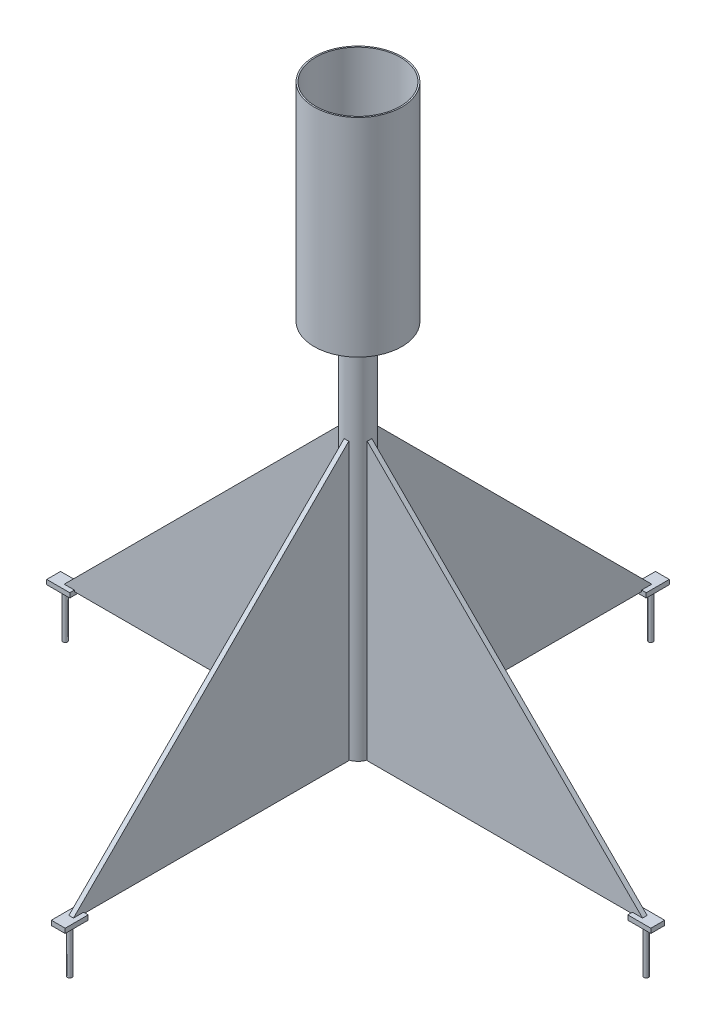
from build123d import *

# Parameters (mm, degrees)
SKETCH1_R            = 95
BOSS_EXTRUDE1_DEPTH  = 450
SHELL2_T             = -3
SKETCH2_R            = 30
BOSS_EXTRUDE2_DEPTH  = 805
SHELL3_T             = -3
BOSS_EXTRUDE3_DEPTH  = 10
BOSS_EXTRUDE4_DEPTH  = 10
BOSS_EXTRUDE5_DEPTH  = 10
BOSS_EXTRUDE6_DEPTH  = 10
SKETCH11_W           = 30
SKETCH11_H           = 50
BOSS_EXTRUDE7_DEPTH  = 10
SKETCH12_W           = 50
SKETCH12_H           = 30
BOSS_EXTRUDE8_DEPTH  = 10
SKETCH13_W           = 50
SKETCH13_H           = 30
BOSS_EXTRUDE9_DEPTH  = 10
SKETCH14_W           = 30
SKETCH14_H           = 50
BOSS_EXTRUDE10_DEPTH = 10
SKETCH17_R           = 5
BOSS_EXTRUDE11_DEPTH = 100
SKETCH18_R           = 5
BOSS_EXTRUDE12_DEPTH = 100
SKETCH19_R           = 5
BOSS_EXTRUDE13_DEPTH = 100
SKETCH20_R           = 5
BOSS_EXTRUDE14_DEPTH = 100


with BuildPart() as part:
    # Sketch1 → Boss-Extrude1 (new body)
    with BuildSketch(Plane(origin=(0, 0, 0), x_dir=(1, 0, 0), z_dir=(0, 1, 0))):
        with Locations(Location((0, 0, 0), (0, 0, 270))):
            Circle(SKETCH1_R)
    extrude(amount=BOSS_EXTRUDE1_DEPTH)

    # Shell2
    shell2_openings = [part.faces().sort_by_distance(p)[0] for p in [
        (0, 450, 0),
    ]]
    offset(amount=SHELL2_T, openings=shell2_openings, kind=Kind.INTERSECTION)

    # Sketch2 → Boss-Extrude2 (add)
    with BuildSketch(Plane.XZ):
        with Locations(Location((0, 0, 0), (0, 0, 270))):
            Circle(SKETCH2_R)
    extrude(amount=BOSS_EXTRUDE2_DEPTH)

    # Shell3
    shell3_openings = [part.faces().sort_by_distance(p)[0] for p in [
        (0, -805, 0),
    ]]
    offset(amount=SHELL3_T, openings=shell3_openings, kind=Kind.INTERSECTION)


with BuildPart() as body_2:
    # Sketch5 → Boss-Extrude3 (new body)
    with BuildSketch(Plane(origin=(0, 0, 0), x_dir=(0, 0, -1), z_dir=(1, 0, 0))):
        Polygon((-30, -205), (-630, -805), (-30, -805), align=None)
    extrude(amount=BOSS_EXTRUDE3_DEPTH)

    # Sketch14 → Boss-Extrude10 (add)
    with BuildSketch(Plane(origin=(0, -802, 0), x_dir=(-1, 0, 0), z_dir=(0, -1, 0))):
        with Locations((-5, -630)):
            Rectangle(SKETCH14_W, SKETCH14_H)
    extrude(amount=BOSS_EXTRUDE10_DEPTH)

    # Sketch18 → Boss-Extrude12 (add)
    with BuildSketch(Plane.XZ.offset(812)):
        with Locations((5, 630)):
            Circle(SKETCH18_R)
    extrude(amount=BOSS_EXTRUDE12_DEPTH)


with BuildPart() as body_3:
    # Sketch6 → Boss-Extrude4 (new body)
    with BuildSketch(Plane(origin=(0, 0, 0), x_dir=(0, 0, -1), z_dir=(1, 0, 0))):
        Polygon((30, -205), (30, -805), (630, -805), align=None)
    extrude(amount=BOSS_EXTRUDE4_DEPTH)

    # Sketch11 → Boss-Extrude7 (add)
    with BuildSketch(Plane(origin=(0, -802, 0), x_dir=(-1, 0, 0), z_dir=(0, -1, 0))):
        with Locations((-5, 630)):
            Rectangle(SKETCH11_W, SKETCH11_H)
    extrude(amount=BOSS_EXTRUDE7_DEPTH)

    # Sketch20 → Boss-Extrude14 (add)
    with BuildSketch(Plane.XZ.offset(812)):
        with Locations((5, -630)):
            Circle(SKETCH20_R)
    extrude(amount=BOSS_EXTRUDE14_DEPTH)


with BuildPart() as body_4:
    # Sketch8 → Boss-Extrude5 (new body)
    with BuildSketch(Plane.XY):
        Polygon((-30, -205), (-30, -805), (-630, -805), align=None)
    extrude(amount=BOSS_EXTRUDE5_DEPTH)

    # Sketch12 → Boss-Extrude8 (add)
    with BuildSketch(Plane(origin=(0, -802, 0), x_dir=(-1, 0, 0), z_dir=(0, -1, 0))):
        with Locations((630, -5)):
            Rectangle(SKETCH12_W, SKETCH12_H)
    extrude(amount=BOSS_EXTRUDE8_DEPTH)

    # Sketch19 → Boss-Extrude13 (add)
    with BuildSketch(Plane.XZ.offset(812)):
        with Locations((-630, 5)):
            Circle(SKETCH19_R)
    extrude(amount=BOSS_EXTRUDE13_DEPTH)


with BuildPart() as body_5:
    # Sketch9 → Boss-Extrude6 (new body)
    with BuildSketch(Plane.XY):
        Polygon((30, -205), (30, -805), (630, -805), align=None)
    extrude(amount=BOSS_EXTRUDE6_DEPTH)

    # Sketch13 → Boss-Extrude9 (add)
    with BuildSketch(Plane(origin=(0, -802, 0), x_dir=(-1, 0, 0), z_dir=(0, -1, 0))):
        with Locations((-630, -5)):
            Rectangle(SKETCH13_W, SKETCH13_H)
    extrude(amount=BOSS_EXTRUDE9_DEPTH)

    # Sketch17 → Boss-Extrude11 (add)
    with BuildSketch(Plane.XZ.offset(812)):
        with Locations((630, 5)):
            Circle(SKETCH17_R)
    extrude(amount=BOSS_EXTRUDE11_DEPTH)


solid = Compound([part.part, body_2.part, body_3.part, body_4.part, body_5.part])
